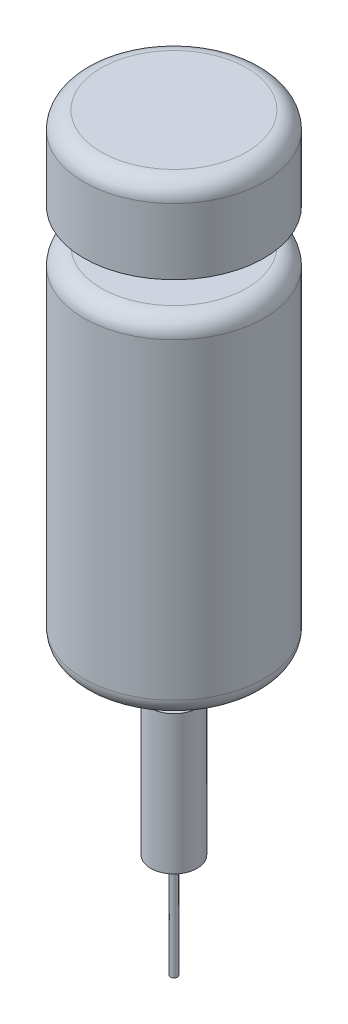
from build123d import *

# Parameters (mm, degrees)
SKETCH1_R           = 26
BOSS_EXTRUDE2_DEPTH = 100
SKETCH2_R           = 7.5
BOSS_EXTRUDE4_DEPTH = 10
SKETCH3_R           = 26
BOSS_EXTRUDE5_DEPTH = 24
FILLET1_R           = 5
FILLET2_R           = 5
FILLET3_R           = 5
SKETCH4_R           = 10
BOSS_EXTRUDE6_DEPTH = 8
SKETCH5_R           = 2.935336569
BOSS_EXTRUDE7_DEPTH = 4
SKETCH6_R           = 6.699984979
BOSS_EXTRUDE8_DEPTH = 40
SKETCH7_R           = 1
BOSS_EXTRUDE9_DEPTH = 30


with BuildPart() as part:
    # Sketch1 → Boss-Extrude2 (new body)
    with BuildSketch(Plane(origin=(0, 0, 0), x_dir=(1, 0, 0), z_dir=(0, 1, 0))):
        with Locations(Location((0, 0, 0), (0, 0, 270))):
            Circle(SKETCH1_R)
    extrude(amount=BOSS_EXTRUDE2_DEPTH)

    # Sketch2 → Boss-Extrude4 (add)
    with BuildSketch(Plane(origin=(0, 100, 0), x_dir=(1, 0, 0), z_dir=(0, 1, 0))):
        with Locations(Location((0, 0, 0), (0, 0, 270))):
            Circle(SKETCH2_R)
    extrude(amount=BOSS_EXTRUDE4_DEPTH)

    # Sketch3 → Boss-Extrude5 (add)
    with BuildSketch(Plane(origin=(0, 110, 0), x_dir=(1, 0, 0), z_dir=(0, 1, 0))):
        with Locations(Location((0, 0, 0), (0, 0, 270))):
            Circle(SKETCH3_R)
    extrude(amount=BOSS_EXTRUDE5_DEPTH)

    # Fillet1
    fillet1_edges = [part.edges().sort_by_distance(p)[0] for p in [
        (0, 0, -26),
    ]]
    fillet(fillet1_edges, radius=FILLET1_R)

    # Fillet2
    fillet2_edges = [part.edges().sort_by_distance(p)[0] for p in [
        (0, 100, -26),
    ]]
    fillet(fillet2_edges, radius=FILLET2_R)

    # Fillet3
    fillet3_edges = [part.edges().sort_by_distance(p)[0] for p in [
        (0, 134, -26),
    ]]
    fillet(fillet3_edges, radius=FILLET3_R)

    # Sketch4 → Boss-Extrude6 (add)
    with BuildSketch(Plane.XZ):
        with Locations(Location((0, 0, 0), (0, 0, 90))):
            Circle(SKETCH4_R)
    extrude(amount=BOSS_EXTRUDE6_DEPTH)

    # Sketch5 → Boss-Extrude7 (add)
    with BuildSketch(Plane.XZ.offset(8)):
        with Locations(Location((0, 0, 0), (0, 0, 270))):
            Circle(SKETCH5_R)
    extrude(amount=BOSS_EXTRUDE7_DEPTH)

    # Sketch6 → Boss-Extrude8 (add)
    with BuildSketch(Plane.XZ.offset(12)):
        with Locations(Location((0, 0, 0), (0, 0, 270))):
            Circle(SKETCH6_R)
    extrude(amount=BOSS_EXTRUDE8_DEPTH)

    # Sketch7 → Boss-Extrude9 (add)
    with BuildSketch(Plane.XZ.offset(52)):
        with Locations(Location((0, 0, 0), (0, 0, 270))):
            Circle(SKETCH7_R)
    extrude(amount=BOSS_EXTRUDE9_DEPTH)


solid = part.part
